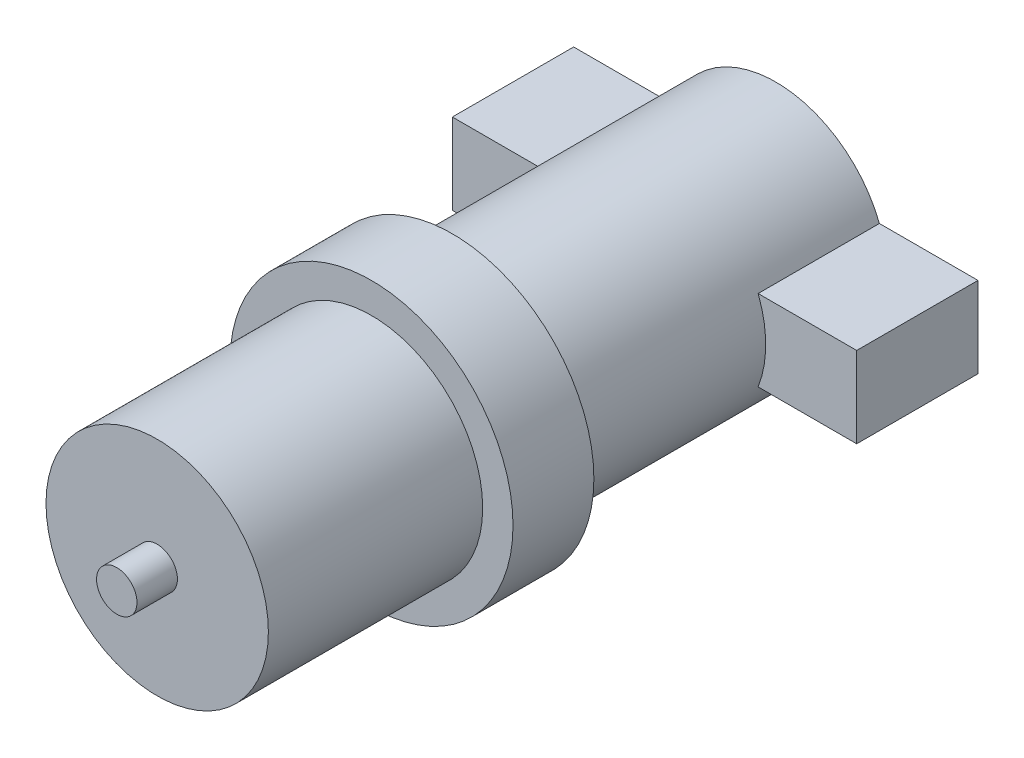
from build123d import *

# Parameters (mm, degrees)
SKETCH1_R           = 6.875
BOSS_EXTRUDE1_DEPTH = 7.5
SKETCH2_R           = 8.75
BOSS_EXTRUDE2_DEPTH = 5
SKETCH3_R           = 6.875
BOSS_EXTRUDE3_DEPTH = 13.25
SKETCH4_R           = 1.25
BOSS_EXTRUDE4_DEPTH = 2.5
BOSS_EXTRUDE5_START = 12.5
SKETCH5_R           = 6.875
BOSS_EXTRUDE5_DEPTH = 12.5
SKETCH8_W           = 25
SKETCH8_H           = 5
BOSS_EXTRUDE6_DEPTH = 7.5


with BuildPart() as part:
    # Sketch1 → Boss-Extrude1 (new body)
    with BuildSketch(Plane.XY):
        Circle(SKETCH1_R)
    extrude(amount=BOSS_EXTRUDE1_DEPTH)

    # Sketch2 → Boss-Extrude2 (add)
    with BuildSketch(Plane.XY.offset(7.5)):
        Circle(SKETCH2_R)
    extrude(amount=BOSS_EXTRUDE2_DEPTH)

    # Sketch3 → Boss-Extrude3 (add)
    with BuildSketch(Plane.XY.offset(12.5)):
        Circle(SKETCH3_R)
    extrude(amount=BOSS_EXTRUDE3_DEPTH)

    # Sketch4 → Boss-Extrude4 (add)
    with BuildSketch(Plane.XY.offset(25.75)):
        Circle(SKETCH4_R)
    extrude(amount=BOSS_EXTRUDE4_DEPTH)

    # Sketch5 → Boss-Extrude5 (add)
    with BuildSketch(Plane(origin=(0, 0, 0), x_dir=(-1, 0, 0), z_dir=(0, 0, -1)).offset(BOSS_EXTRUDE5_START)):
        Circle(SKETCH5_R)
    extrude(amount=-BOSS_EXTRUDE5_DEPTH)

    # Sketch8 → Boss-Extrude6 (add)
    with BuildSketch(Plane(origin=(0, 0, -12.5), x_dir=(-1, 0, 0), z_dir=(0, 0, -1))):
        Rectangle(SKETCH8_W, SKETCH8_H)
    extrude(amount=-BOSS_EXTRUDE6_DEPTH)


solid = part.part
